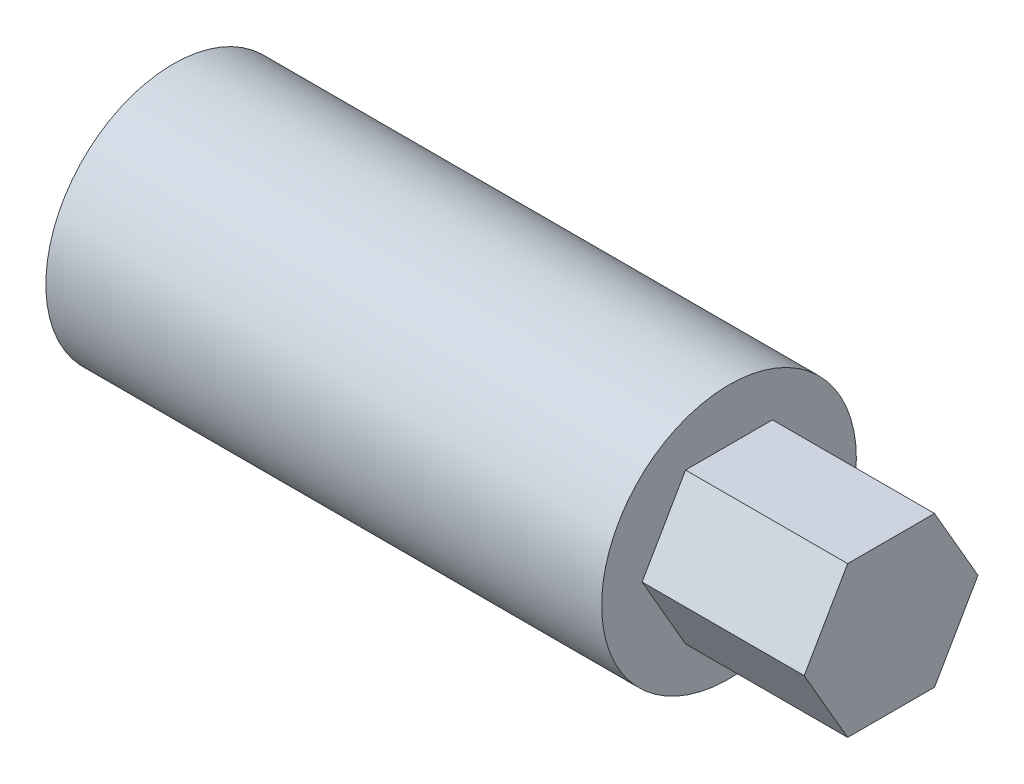
from build123d import *

# Parameters (mm, degrees)
ESBO_O1_R                = 11
RESSALTO_EXTRUS_O1_DEPTH = 62
CORTE_EXTRUS_O1_START    = -14
ESBO_O2_R                = 11
CORTE_EXTRUS_O1_DEPTH    = 14


with BuildPart() as part:
    # Esboço1 → Ressalto-extrusão1 (new body)
    with BuildSketch(Plane.YZ):
        with Locations(Location((0, 0, 0), (0, 0, 270))):
            Circle(ESBO_O1_R)
    extrude(amount=RESSALTO_EXTRUS_O1_DEPTH)

    # Esboço2 → Corte-extrusão1 (cut)
    with BuildSketch(Plane.YZ.offset(62).offset(CORTE_EXTRUS_O1_START)):
        with Locations(Location((0, 0, 0), (0, 0, 270))):
            Circle(ESBO_O2_R)
        Polygon((0, 7.505553499), (-6.5, 3.75277675), (-6.5, -3.75277675), (0, -7.505553499), (6.5, -3.75277675), (6.5, 3.75277675), align=None, mode=Mode.SUBTRACT)
    extrude(amount=CORTE_EXTRUS_O1_DEPTH, mode=Mode.SUBTRACT)


solid = part.part
